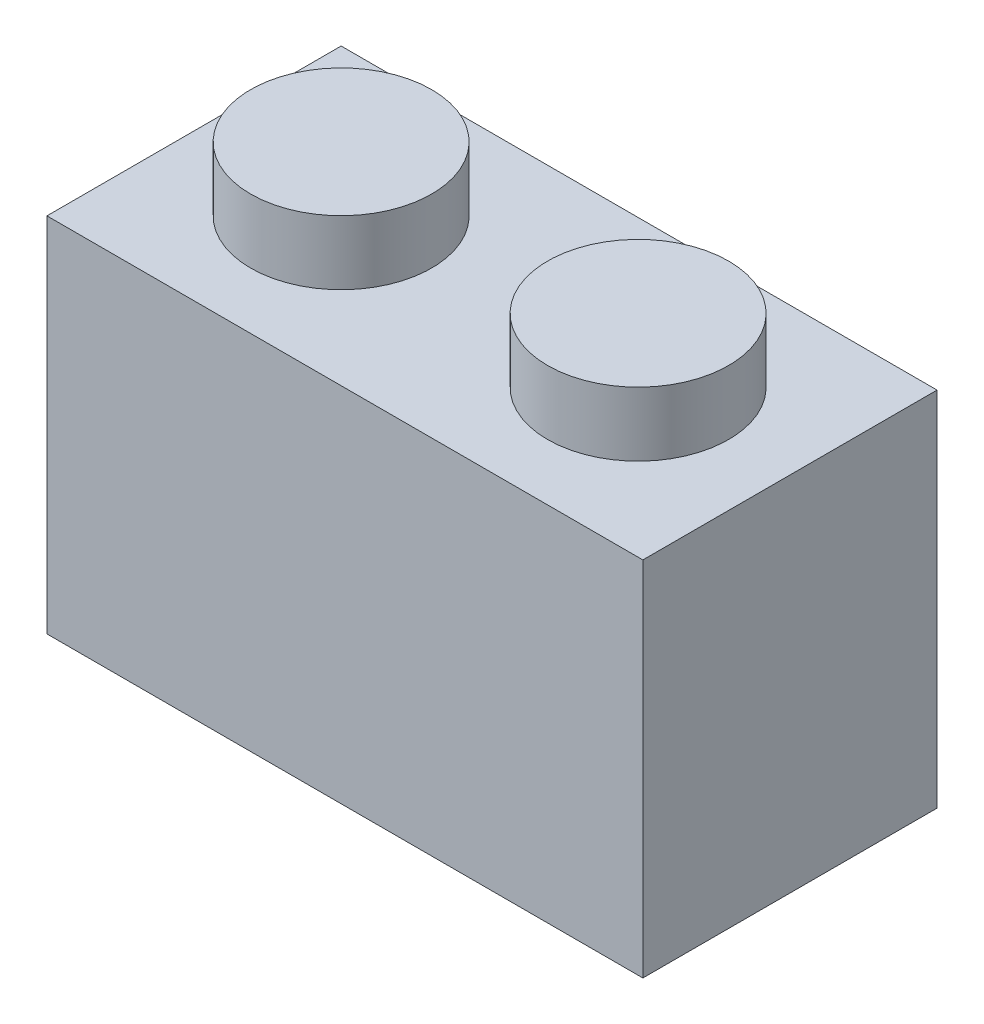
from build123d import *

# Parameters (mm, degrees)
SKETCH_1_W          = 15.8
SKETCH_1_H          = 7.799999894
EXTRUDE_2_DEPTH     = 9.6
SKETCH_2_R          = 2.4
EXTRUDE_3_DEPTH     = 1.7
SKETCH_3_R          = 2.5
CUT_EXTRUDE_1_DEPTH = 1.8


with BuildPart() as part:
    # Эскиз1 → Бобышка-Вытянуть2 (new body)
    with BuildSketch(Plane(origin=(0, 0, 0), x_dir=(1, 0, 0), z_dir=(0, 1, 0))):
        Rectangle(SKETCH_1_W, SKETCH_1_H)
    extrude(amount=EXTRUDE_2_DEPTH)

    # Эскиз2 → Бобышка-Вытянуть3 (add)
    with BuildSketch(Plane(origin=(0, 9.6, 0), x_dir=(1, 0, 0), z_dir=(0, 1, 0))):
        with Locations(Location((-4, -5.3e-08, 0), (0, 0, 270))):
            Circle(SKETCH_2_R)
        with Locations(Location((3.874, -5.3e-08, 0), (0, 0, 270))):
            Circle(SKETCH_2_R)
    extrude(amount=EXTRUDE_3_DEPTH)

    # Эскиз3 → Вырез-Вытянуть1 (cut)
    with BuildSketch(Plane.XZ):
        with Locations(Location((-4, 5.3e-08, 0), (0, 0, 270))):
            Circle(SKETCH_3_R)
        with Locations(Location((3.874, 5.3e-08, 0), (0, 0, 270))):
            Circle(SKETCH_3_R)
    extrude(amount=-CUT_EXTRUDE_1_DEPTH, mode=Mode.SUBTRACT)


solid = part.part
